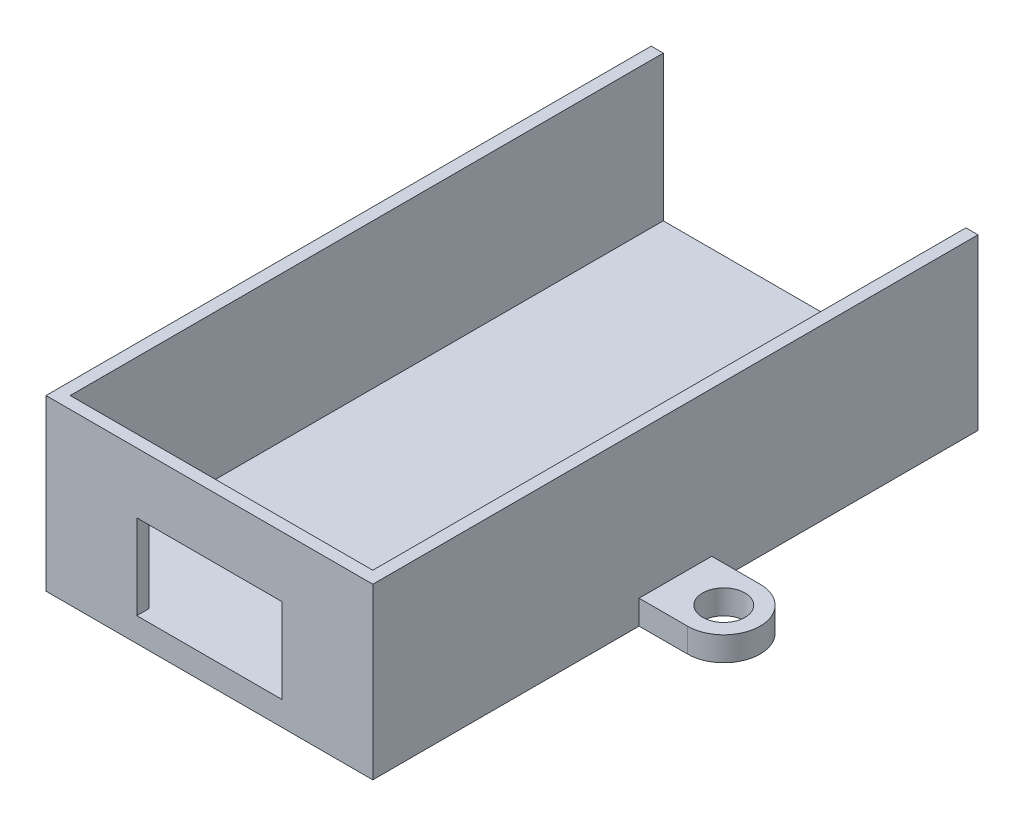
from build123d import *

# Parameters (mm, degrees)
SKETCH1_W           = 27
SKETCH1_H           = 50
SKETCH1_R           = 3
SKETCH1_R_2         = 1.75
BOSS_EXTRUDE1_DEPTH = 2
BOSS_EXTRUDE2_DEPTH = 12
SKETCH4_W           = 12
SKETCH4_H           = 7
CUT_EXTRUDE1_DEPTH  = 56.823382198


with BuildPart() as part:
    # Sketch1 → Boss-Extrude1 (new body)
    # profile 1 of 5: a face of its own
    with BuildSketch(Plane(origin=(0, 0, 0), x_dir=(1, 0, 0), z_dir=(0, 1, 0))):
        Rectangle(SKETCH1_W, SKETCH1_H)
    # profile 2 of 5: a face of its own
    with BuildSketch(Plane(origin=(0, 0, 0), x_dir=(1, 0, 0), z_dir=(0, 1, 0))):
        with BuildLine():
            Line((-17.5, -3), (-13.5, -3))
            Line((-13.5, -3), (-13.5, 3))
            Line((-13.5, 3), (-17.5, 3))
            ThreePointArc((-17.5, 3), (-15.378679656, 2.121320344), (-14.5, 0))
            ThreePointArc((-14.5, 0), (-15.378679656, -2.121320344), (-17.5, -3))
        make_face()
    # profile 3 of 5: a face of its own
    with BuildSketch(Plane(origin=(0, 0, 0), x_dir=(1, 0, 0), z_dir=(0, 1, 0))):
        with Locations((-17.5, 0)):
            Circle(SKETCH1_R)
        with Locations(Location((-17.5, 0, 0), (0, 0, 270))):
            Circle(SKETCH1_R_2, mode=Mode.SUBTRACT)
    # profile 4 of 5: a face of its own
    with BuildSketch(Plane(origin=(0, 0, 0), x_dir=(1, 0, 0), z_dir=(0, 1, 0))):
        with BuildLine():
            Line((13.5, 3), (13.5, -3))
            Line((13.5, -3), (17.5, -3))
            ThreePointArc((17.5, -3), (14.5, 0), (17.5, 3))
            Line((17.5, 3), (13.5, 3))
        make_face()
    # profile 5 of 5: a face of its own
    with BuildSketch(Plane(origin=(0, 0, 0), x_dir=(1, 0, 0), z_dir=(0, 1, 0))):
        with Locations((17.5, 0)):
            Circle(SKETCH1_R)
        with Locations(Location((17.5, 0, 0), (0, 0, 270))):
            Circle(SKETCH1_R_2, mode=Mode.SUBTRACT)
    extrude(amount=BOSS_EXTRUDE1_DEPTH)

    # Sketch2 → Boss-Extrude2 (add)
    with BuildSketch(Plane(origin=(0, 2, 0), x_dir=(1, 0, 0), z_dir=(0, 1, 0))):
        Polygon((-13.5, 25), (-13.5, -25), (13.5, -25), (13.5, 25), (12.5, 25), (12.5, -24), (-12.5, -24), (-12.5, 25), align=None)
    extrude(amount=BOSS_EXTRUDE2_DEPTH)

    # Sketch4 → Cut-Extrude1 (cut, through all)
    with BuildSketch(Plane.XY.offset(25)):
        with Locations((0, 5.5)):
            Rectangle(SKETCH4_W, SKETCH4_H)
    extrude(amount=-CUT_EXTRUDE1_DEPTH, mode=Mode.SUBTRACT)


solid = part.part
